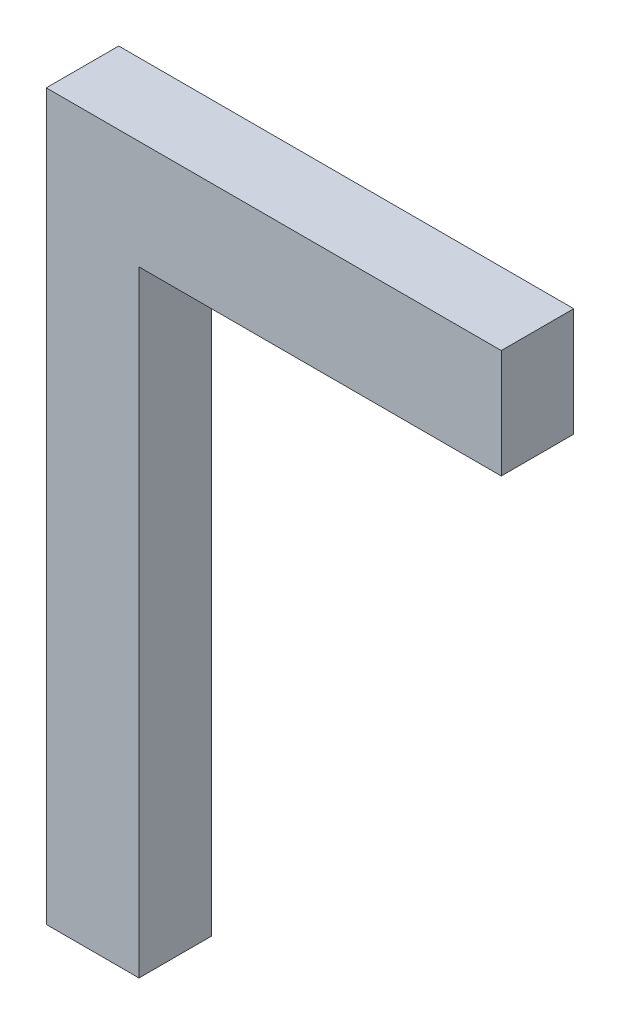
from build123d import *

# Parameters (mm, degrees)
SKETCH2_W           = 128
SKETCH2_H           = 100
BOSS_EXTRUDE1_DEPTH = 1000
SKETCH3_W           = 100
SKETCH3_H           = 150
BOSS_EXTRUDE2_DEPTH = 500


with BuildPart() as part:
    # Sketch2 → Boss-Extrude1 (new body)
    with BuildSketch(Plane(origin=(0, 0, 0), x_dir=(1, 0, 0), z_dir=(0, 1, 0))):
        Rectangle(SKETCH2_W, SKETCH2_H)
    extrude(amount=BOSS_EXTRUDE1_DEPTH)

    # Sketch3 → Boss-Extrude2 (add)
    with BuildSketch(Plane(origin=(64, 0, 0), x_dir=(0, 0, -1), z_dir=(1, 0, 0))):
        with Locations((0, 925)):
            Rectangle(SKETCH3_W, SKETCH3_H)
    extrude(amount=BOSS_EXTRUDE2_DEPTH)


solid = part.part
